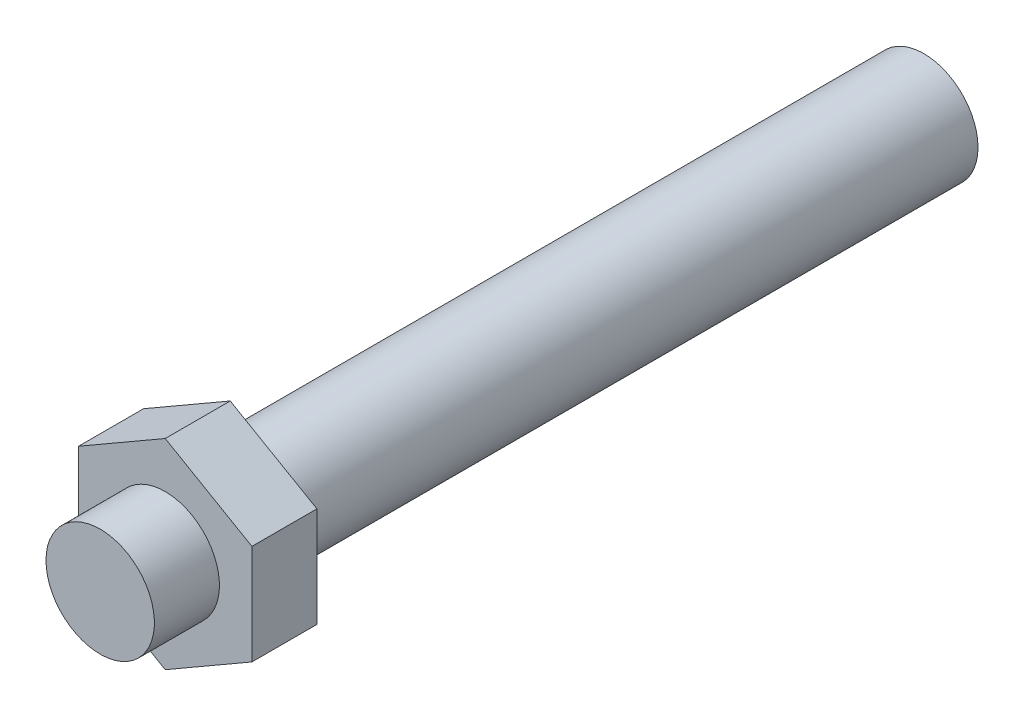
from build123d import *

# Parameters (mm, degrees)
SKETCH1_R           = 7.9375
BASE_EXTRUDE_DEPTH  = 101.6
BOSS_EXTRUDE1_DEPTH = 9.525
SKETCH3_R           = 7.9375
BOSS_EXTRUDE2_DEPTH = 9.525


with BuildPart() as part:
    # Sketch1 → Base-Extrude (new body)
    with BuildSketch(Plane.XY):
        Circle(SKETCH1_R)
    extrude(amount=BASE_EXTRUDE_DEPTH)

    # Sketch2 → Boss-Extrude1 (add)
    with BuildSketch(Plane.XY.offset(101.6)):
        Polygon((12.7, -7.332348419), (12.7, 7.332348419), (0, 14.664696837), (-12.7, 7.332348419), (-12.7, -7.332348419), (0, -14.664696837), align=None)
    extrude(amount=BOSS_EXTRUDE1_DEPTH)

    # Sketch3 → Boss-Extrude2 (add)
    with BuildSketch(Plane.XY.offset(111.125)):
        Circle(SKETCH3_R)
    extrude(amount=BOSS_EXTRUDE2_DEPTH)


solid = part.part
